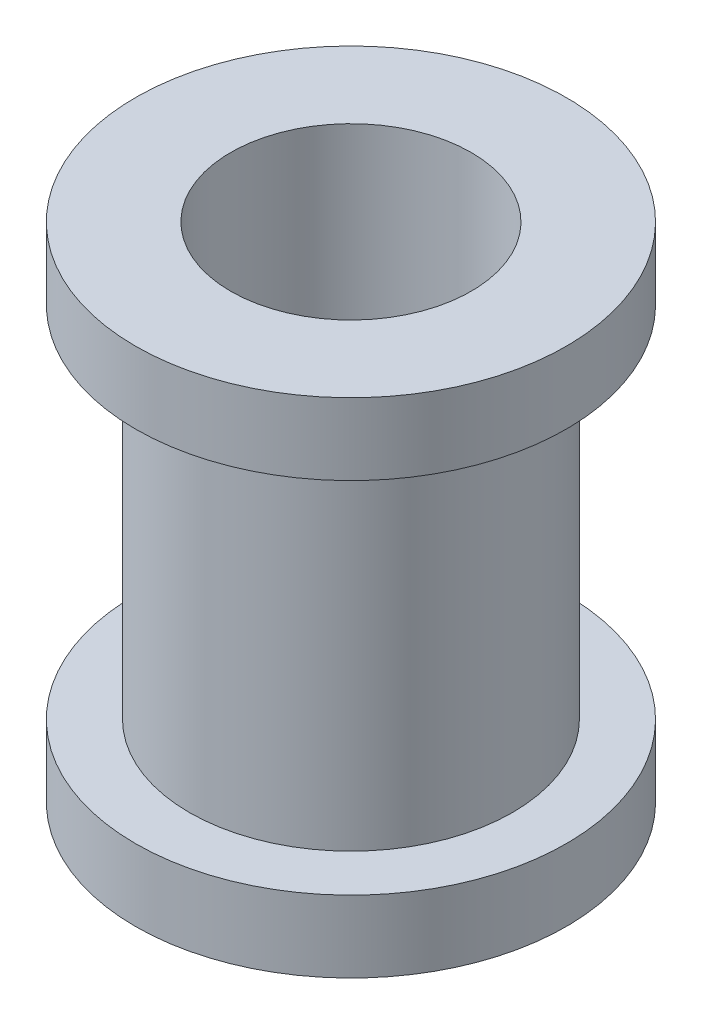
from build123d import *

# Parameters (mm, degrees)
SKETCH1_R           = 4.5
SKETCH1_R_2         = 3.35
BOSS_EXTRUDE1_DEPTH = 5
SKETCH2_R           = 6
SKETCH2_R_2         = 3.35
BOSS_EXTRUDE2_DEPTH = 2


with BuildPart() as part:
    # Sketch1 → Boss-Extrude1 (new, symmetric)
    with BuildSketch(Plane(origin=(0, 0, 0), x_dir=(1, 0, 0), z_dir=(0, 1, 0))):
        with Locations(Location((0, 0, 0), (0, 0, 270))):
            Circle(SKETCH1_R)
        with Locations(Location((0, 0, 0), (0, 0, 270))):
            Circle(SKETCH1_R_2, mode=Mode.SUBTRACT)
    extrude(amount=BOSS_EXTRUDE1_DEPTH, both=True)

    # Sketch2 → Boss-Extrude2 (add)
    with BuildSketch(Plane(origin=(0, 5, 0), x_dir=(1, 0, 0), z_dir=(0, 1, 0))):
        with Locations(Location((0, 0, 0), (0, 0, 270))):
            Circle(SKETCH2_R)
        with Locations(Location((0, 0, 0), (0, 0, 270))):
            Circle(SKETCH2_R_2, mode=Mode.SUBTRACT)
    boss_extrude2 = extrude(amount=BOSS_EXTRUDE2_DEPTH)

    # Mirror1: Boss-Extrude2 across plane
    add(boss_extrude2.mirror(Plane.ZX))


solid = part.part
